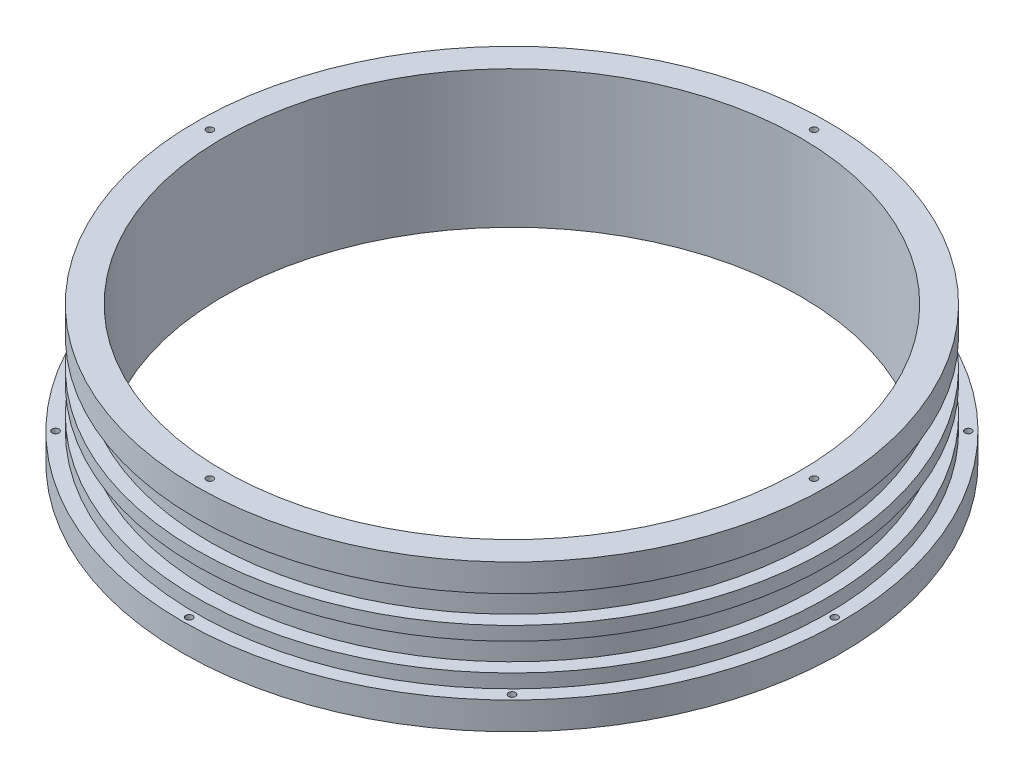
from build123d import *

# Parameters (mm, degrees)
SKETCH2_R           = 76.2
BOSS_EXTRUDE1_DEPTH = 6.35
SKETCH3_R           = 73.025
BOSS_EXTRUDE2_DEPTH = 9.525
SKETCH4_R           = 69.85
BOSS_EXTRUDE3_DEPTH = 15.875
SKETCH6_R           = 73.025
BOSS_EXTRUDE4_DEPTH = 3.175
SKETCH7_R           = 69.85
BOSS_EXTRUDE5_DEPTH = 6.35
SKETCH8_R           = 73.025
BOSS_EXTRUDE6_DEPTH = 6.35
SKETCH9_R           = 66.675
CUT_EXTRUDE1_DEPTH  = 113.342968182
SKETCH10_R          = 0.79375
CUT_EXTRUDE2_DEPTH  = 111.716033166
SKETCH11_R          = 73.025
SKETCH11_R_2        = 69.85
CUT_EXTRUDE3_DEPTH  = 3.175
SKETCH12_R          = 0.79375
CUT_EXTRUDE4_DEPTH  = 3.175


with BuildPart() as part:
    # Sketch2 → Boss-Extrude1 (new body)
    with BuildSketch(Plane(origin=(0, 0, 0), x_dir=(1, 0, 0), z_dir=(0, 1, 0))):
        with Locations(Location((0, 0, 0), (0, 0, 270))):
            Circle(SKETCH2_R)
    extrude(amount=BOSS_EXTRUDE1_DEPTH)

    # Sketch3 → Boss-Extrude2 (add)
    with BuildSketch(Plane(origin=(0, 0, 0), x_dir=(1, 0, 0), z_dir=(0, 1, 0))):
        with Locations(Location((0, 0, 0), (0, 0, 90))):
            Circle(SKETCH3_R)
    extrude(amount=BOSS_EXTRUDE2_DEPTH)

    # Sketch4 → Boss-Extrude3 (add)
    with BuildSketch(Plane(origin=(0, 0, 0), x_dir=(1, 0, 0), z_dir=(0, 1, 0))):
        with Locations(Location((0, 0, 0), (0, 0, 270))):
            Circle(SKETCH4_R)
    extrude(amount=BOSS_EXTRUDE3_DEPTH)

    # Sketch6 → Boss-Extrude4 (add)
    with BuildSketch(Plane(origin=(0, 15.875, 0), x_dir=(1, 0, 0), z_dir=(0, 1, 0))):
        with Locations(Location((0, 0, 0), (0, 0, 90))):
            Circle(SKETCH6_R)
    extrude(amount=BOSS_EXTRUDE4_DEPTH)

    # Sketch7 → Boss-Extrude5 (add)
    with BuildSketch(Plane(origin=(0, 19.05, 0), x_dir=(1, 0, 0), z_dir=(0, 1, 0))):
        with Locations(Location((0, 0, 0), (0, 0, 270))):
            Circle(SKETCH7_R)
    extrude(amount=BOSS_EXTRUDE5_DEPTH)

    # Sketch8 → Boss-Extrude6 (add)
    with BuildSketch(Plane(origin=(0, 25.4, 0), x_dir=(1, 0, 0), z_dir=(0, 1, 0))):
        with Locations(Location((0, 0, 0), (0, 0, 90))):
            Circle(SKETCH8_R)
    extrude(amount=BOSS_EXTRUDE6_DEPTH)

    # Sketch9 → Cut-Extrude1 (cut, through all)
    with BuildSketch(Plane.XZ):
        with Locations(Location((0, 0, 0), (0, 0, 270))):
            Circle(SKETCH9_R)
    extrude(amount=-CUT_EXTRUDE1_DEPTH, mode=Mode.SUBTRACT)

    # Sketch10 → Cut-Extrude2 (cut, through all)
    with BuildSketch(Plane(origin=(0, 6.35, 0), x_dir=(1, 0, 0), z_dir=(0, 1, 0))):
        with Locations(Location((0, 74.6125, 0), (0, 0, 270))):
            Circle(SKETCH10_R)
        with Locations(Location((52.759004711, 52.759004711, 0), (0, 0, 270))):
            Circle(SKETCH10_R)
        with Locations(Location((74.6125, 0, 0), (0, 0, 270))):
            Circle(SKETCH10_R)
        with Locations(Location((52.759004711, -52.759004711, 0), (0, 0, 270))):
            Circle(SKETCH10_R)
        with Locations(Location((0, -74.6125, 0), (0, 0, 270))):
            Circle(SKETCH10_R)
        with Locations(Location((-52.759004711, -52.759004711, 0), (0, 0, 270))):
            Circle(SKETCH10_R)
        with Locations(Location((-74.6125, 0, 0), (0, 0, 270))):
            Circle(SKETCH10_R)
        with Locations(Location((-52.759004711, 52.759004711, 0), (0, 0, 270))):
            Circle(SKETCH10_R)
    extrude(amount=-CUT_EXTRUDE2_DEPTH, mode=Mode.SUBTRACT)

    # Sketch11 → Cut-Extrude3 (cut)
    with BuildSketch(Plane.XZ):
        with Locations(Location((0, 0, 0), (0, 0, 270))):
            Circle(SKETCH11_R)
        with Locations(Location((0, 0, 0), (0, 0, 90))):
            Circle(SKETCH11_R_2, mode=Mode.SUBTRACT)
    extrude(amount=-CUT_EXTRUDE3_DEPTH, mode=Mode.SUBTRACT)

    # Sketch12 → Cut-Extrude4 (cut)
    with BuildSketch(Plane(origin=(0, 31.75, 0), x_dir=(1, 0, 0), z_dir=(0, 1, 0))):
        with Locations(Location((0, -69.85, 0), (0, 0, 270))):
            Circle(SKETCH12_R)
        with Locations(Location((-69.85, 0, 0), (0, 0, 270))):
            Circle(SKETCH12_R)
        with Locations(Location((0, 69.85, 0), (0, 0, 270))):
            Circle(SKETCH12_R)
        with Locations(Location((69.85, 0, 0), (0, 0, 270))):
            Circle(SKETCH12_R)
    extrude(amount=-CUT_EXTRUDE4_DEPTH, mode=Mode.SUBTRACT)


solid = part.part
